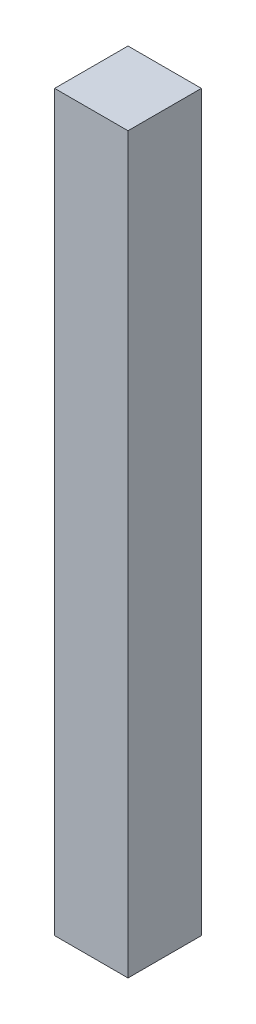
from build123d import *

# Parameters (mm, degrees)
SKIZZE1_W                       = 75
SKIZZE1_H                       = 75
AUFSATZ_LINEAR_AUSTRAGEN1_DEPTH = 750


with BuildPart() as part:
    # Skizze1 → Aufsatz-Linear austragen1 (new body)
    with BuildSketch(Plane(origin=(0, 0, 0), x_dir=(1, 0, 0), z_dir=(0, 1, 0))):
        Rectangle(SKIZZE1_W, SKIZZE1_H)
    extrude(amount=AUFSATZ_LINEAR_AUSTRAGEN1_DEPTH)


solid = part.part
